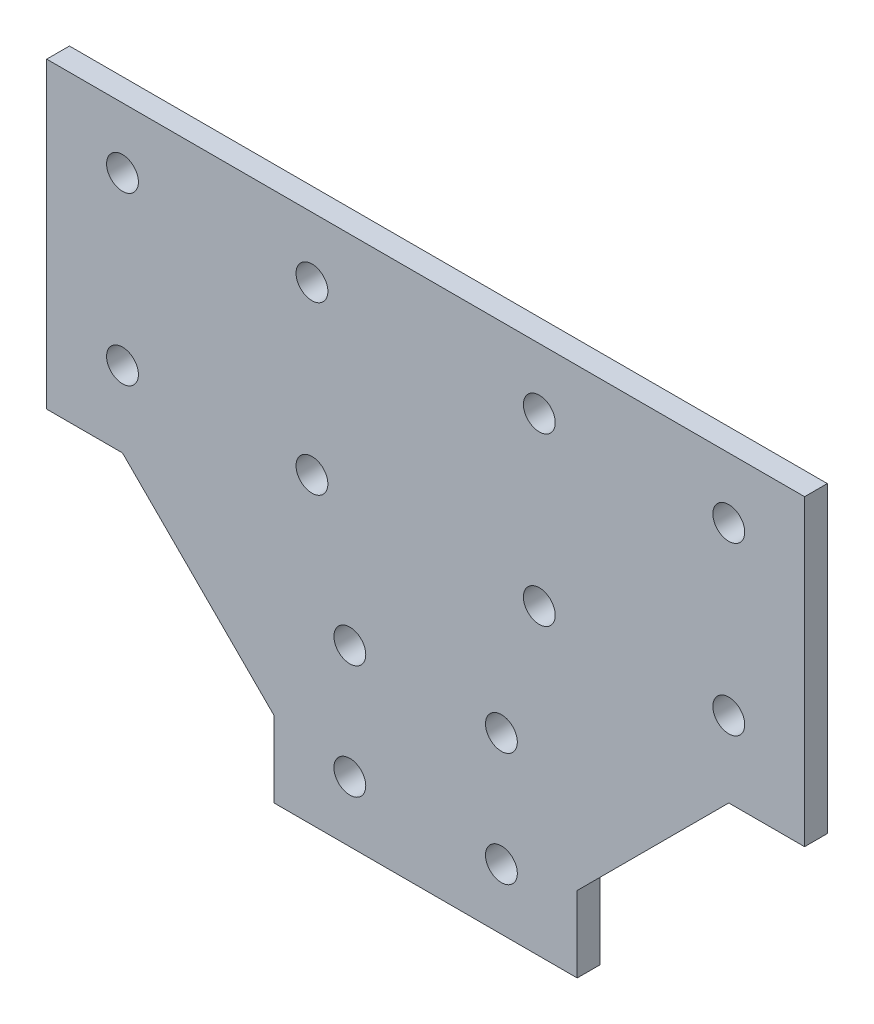
from build123d import *

# Parameters (mm, degrees)
EXTRUDE_1_DEPTH     = 3
SKETCH_2_R          = 2.1
CUT_EXTRUDE_1_DEPTH = 3


with BuildPart() as part:
    # 草图1 → 凸台-拉伸1 (new body)
    with BuildSketch(Plane.XY):
        Polygon((-20, 0), (-30, 0), (-30, 40), (70, 40), (70, 0), (60, 0), (40, -20), (40, -30), (0, -30), (0, -20), align=None)
    extrude(amount=EXTRUDE_1_DEPTH)

    # 草图2 → 切除-拉伸1 (cut)
    with BuildSketch(Plane.XY.offset(3)):
        with Locations((10, -7)):
            Circle(SKETCH_2_R)
        with Locations((30, -7)):
            Circle(SKETCH_2_R)
        with Locations((10, -22)):
            Circle(SKETCH_2_R)
        with Locations((30, -22)):
            Circle(SKETCH_2_R)
        with Locations((-20, 10)):
            Circle(SKETCH_2_R)
        with Locations((-20, 32)):
            Circle(SKETCH_2_R)
        with Locations((5, 10)):
            Circle(SKETCH_2_R)
        with Locations((35, 10)):
            Circle(SKETCH_2_R)
        with Locations((60, 10)):
            Circle(SKETCH_2_R)
        with Locations((60, 32)):
            Circle(SKETCH_2_R)
        with Locations((35, 32)):
            Circle(SKETCH_2_R)
        with Locations((5, 32)):
            Circle(SKETCH_2_R)
    extrude(amount=-CUT_EXTRUDE_1_DEPTH, mode=Mode.SUBTRACT)


solid = part.part
